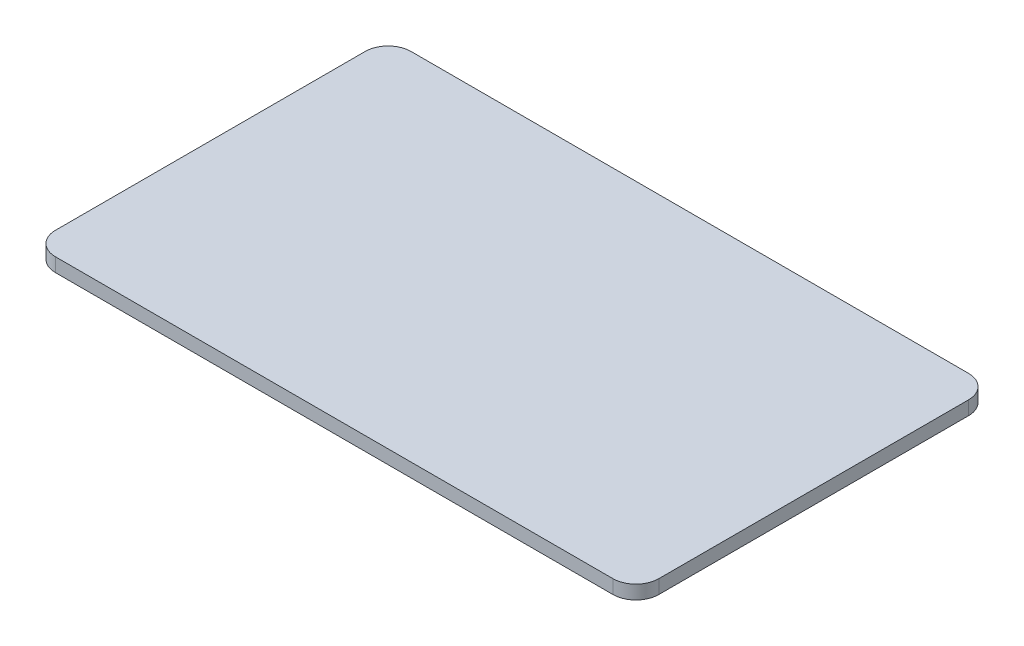
from build123d import *

# Parameters (mm, degrees)
BOSS_EXTRUDE1_DEPTH = 3.81


with BuildPart() as part:
    # Sketch1 → Boss-Extrude1 (new body)
    with BuildSketch(Plane(origin=(0, 0, 0), x_dir=(1, 0, 0), z_dir=(0, 1, 0))):
        with BuildLine():
            Line((-58.736057909, -27.126921458), (95.568942091, -27.126921458))
            ThreePointArc((95.568942091, -27.126921458), (100.059070151, -25.267049519), (101.918942091, -20.776921458))
            Line((101.918942091, -20.776921458), (101.918942091, 64.948078542))
            ThreePointArc((101.918942091, 64.948078542), (100.059070151, 69.438206603), (95.568942091, 71.298078542))
            Line((95.568942091, 71.298078542), (-58.736057909, 71.298078542))
            ThreePointArc((-58.736057909, 71.298078542), (-63.22618597, 69.438206603), (-65.086057909, 64.948078542))
            Line((-65.086057909, 64.948078542), (-65.086057909, -20.776921458))
            ThreePointArc((-65.086057909, -20.776921458), (-63.22618597, -25.267049519), (-58.736057909, -27.126921458))
        make_face()
    extrude(amount=BOSS_EXTRUDE1_DEPTH)


solid = part.part
